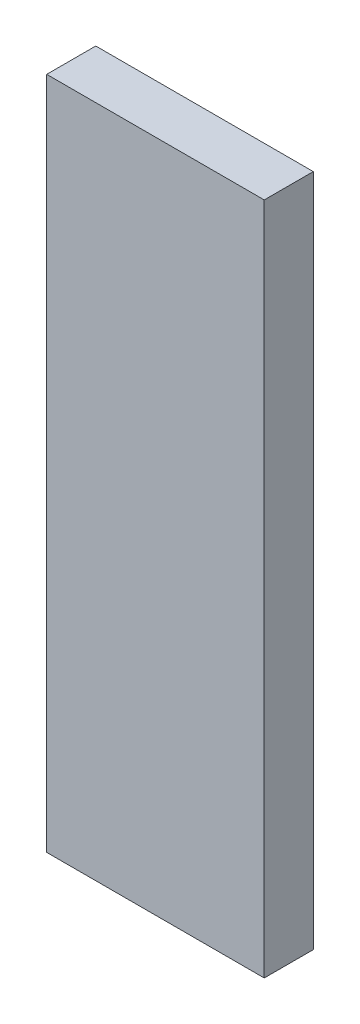
from build123d import *

# Parameters (mm, degrees)
SKETCH_1_W      = 133
SKETCH_1_H      = 412
EXTRUDE_1_DEPTH = 30


with BuildPart() as part:
    # Эскиз1 → Бобышка-Вытянуть1 (new body)
    with BuildSketch(Plane.XY):
        Rectangle(SKETCH_1_W, SKETCH_1_H)
    extrude(amount=EXTRUDE_1_DEPTH)


solid = part.part
